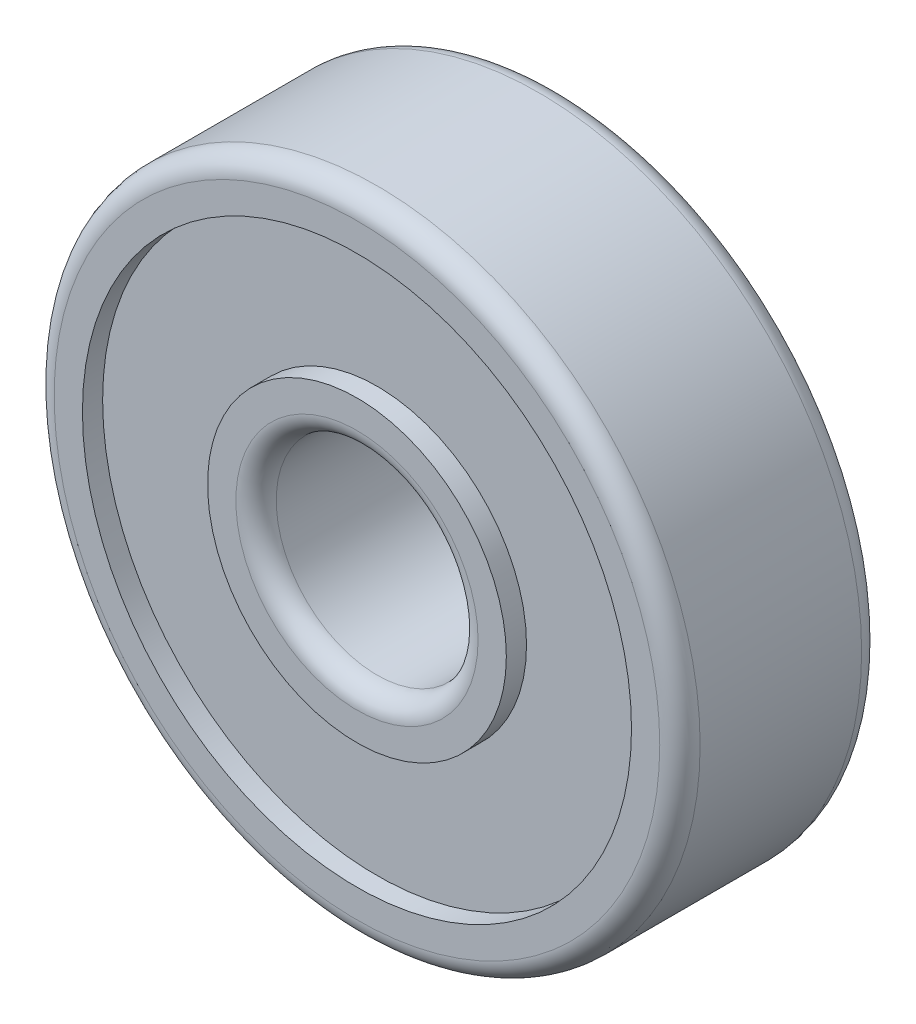
from build123d import *

# Parameters (mm, degrees)
ESBO_O1_R                = 8
ESBO_O1_R_2              = 2.5
RESSALTO_EXTRUS_O1_DEPTH = 5
ESBO_O2_R                = 6.8
ESBO_O2_R_2              = 3.7
CORTE_EXTRUS_O1_DEPTH    = 0.5
CORTE_EXTRUS_O2_START    = -0.5
ESBO_O3_R                = 6.8
ESBO_O3_R_2              = 3.7
CORTE_EXTRUS_O2_DEPTH    = 0.5
FILETE1_R                = 0.5


with BuildPart() as part:
    # Esboço1 → Ressalto-extrusão1 (new body)
    with BuildSketch(Plane.XY):
        Circle(ESBO_O1_R)
        Circle(ESBO_O1_R_2, mode=Mode.SUBTRACT)
    extrude(amount=RESSALTO_EXTRUS_O1_DEPTH)

    # Esboço2 → Corte-extrusão1 (cut)
    with BuildSketch(Plane.XY.offset(5)):
        Circle(ESBO_O2_R)
        Circle(ESBO_O2_R_2, mode=Mode.SUBTRACT)
    extrude(amount=-CORTE_EXTRUS_O1_DEPTH, mode=Mode.SUBTRACT)

    # Esboço3 → Corte-extrusão2 (cut)
    with BuildSketch(Plane(origin=(0, 0, 0), x_dir=(-1, 0, 0), z_dir=(0, 0, -1)).offset(CORTE_EXTRUS_O2_START)):
        with Locations(Location((0, 0, 0), (0, 0, 180))):
            Circle(ESBO_O3_R)
        with Locations(Location((0, 0, 0), (0, 0, 180))):
            Circle(ESBO_O3_R_2, mode=Mode.SUBTRACT)
    extrude(amount=CORTE_EXTRUS_O2_DEPTH, mode=Mode.SUBTRACT)

    # Filete1
    filete1_edges = [part.edges().sort_by_distance(p)[0] for p in [
        (-8, 0, 0),
        (-8, 0, 5),
        (-2.5, 0, 0),
        (-2.5, 0, 5),
    ]]
    fillet(filete1_edges, radius=FILETE1_R)


solid = part.part
